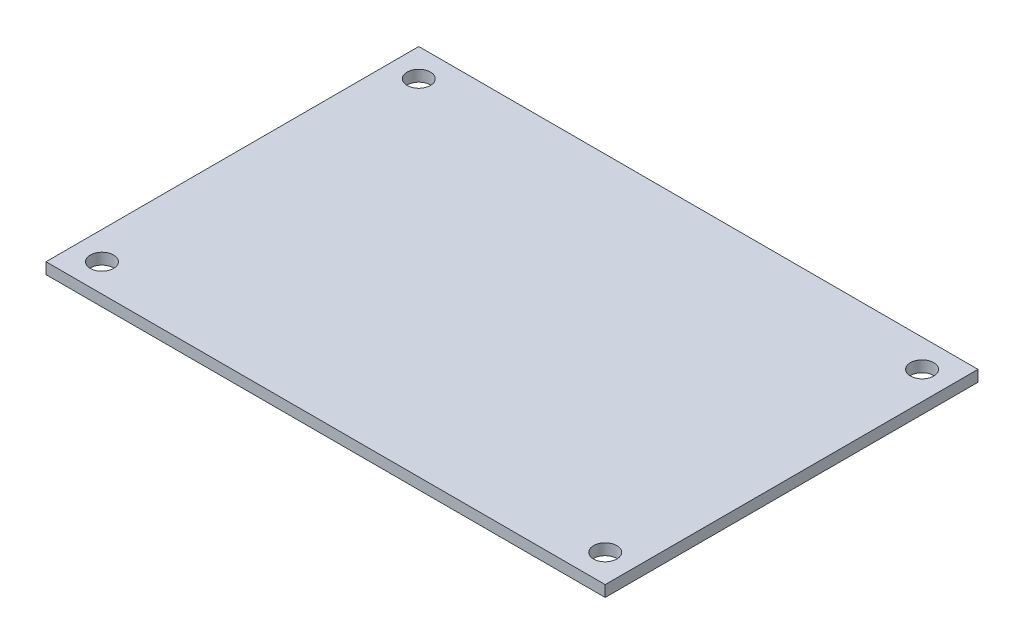
from build123d import *

# Parameters (mm, degrees)
SKETCH1_W           = 76.2
SKETCH1_H           = 50.8
SKETCH1_R           = 1.5875
BOSS_EXTRUDE1_DEPTH = 1.524


with BuildPart() as part:
    # Sketch1 → Boss-Extrude1 (new body)
    with BuildSketch(Plane(origin=(0, 0, 0), x_dir=(1, 0, 0), z_dir=(0, 1, 0))):
        Rectangle(SKETCH1_W, SKETCH1_H)
        with Locations(Location((34.29, 21.59, 0), (0, 0, 90))):
            Circle(SKETCH1_R, mode=Mode.SUBTRACT)
        with Locations(Location((34.29, -21.59, 0), (0, 0, 90))):
            Circle(SKETCH1_R, mode=Mode.SUBTRACT)
        with Locations(Location((-34.29, -21.59, 0), (0, 0, 90))):
            Circle(SKETCH1_R, mode=Mode.SUBTRACT)
        with Locations(Location((-34.29, 21.59, 0), (0, 0, 90))):
            Circle(SKETCH1_R, mode=Mode.SUBTRACT)
    extrude(amount=BOSS_EXTRUDE1_DEPTH)


solid = part.part
